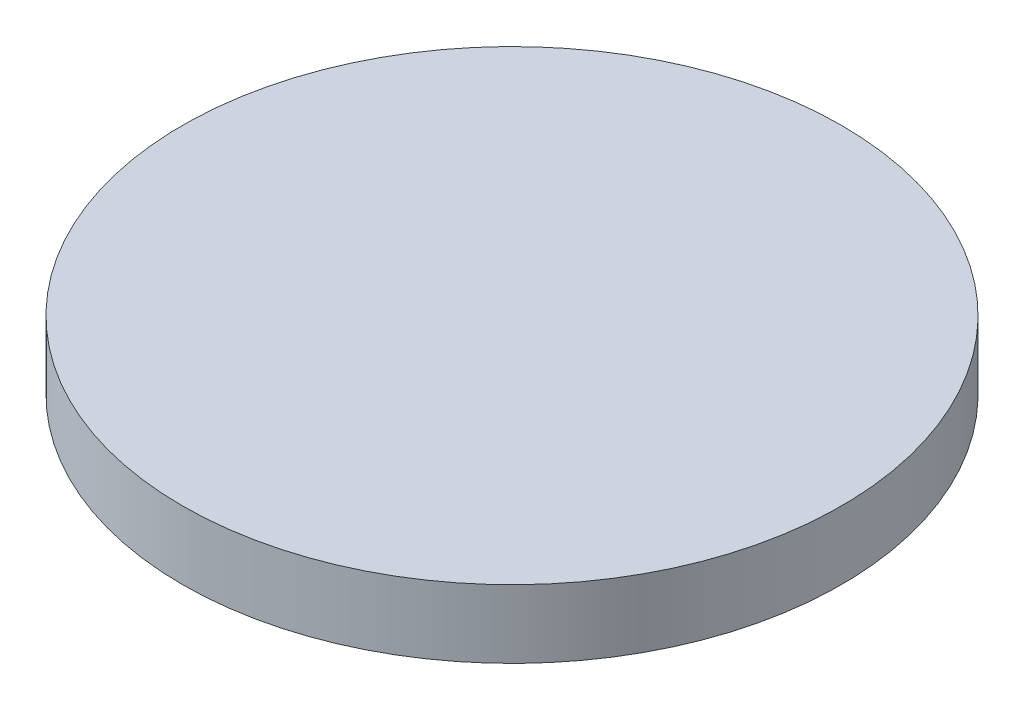
from build123d import *

# Parameters (mm, degrees)
SKETCH_1_R      = 145
EXTRUDE_1_DEPTH = 30


with BuildPart() as part:
    # 草图1 → 凸台-拉伸1 (new body)
    with BuildSketch(Plane(origin=(0, 0, 0), x_dir=(1, 0, 0), z_dir=(0, 1, 0))):
        with Locations(Location((0, 0, 0), (0, 0, 270))):
            Circle(SKETCH_1_R)
    extrude(amount=EXTRUDE_1_DEPTH)


solid = part.part
